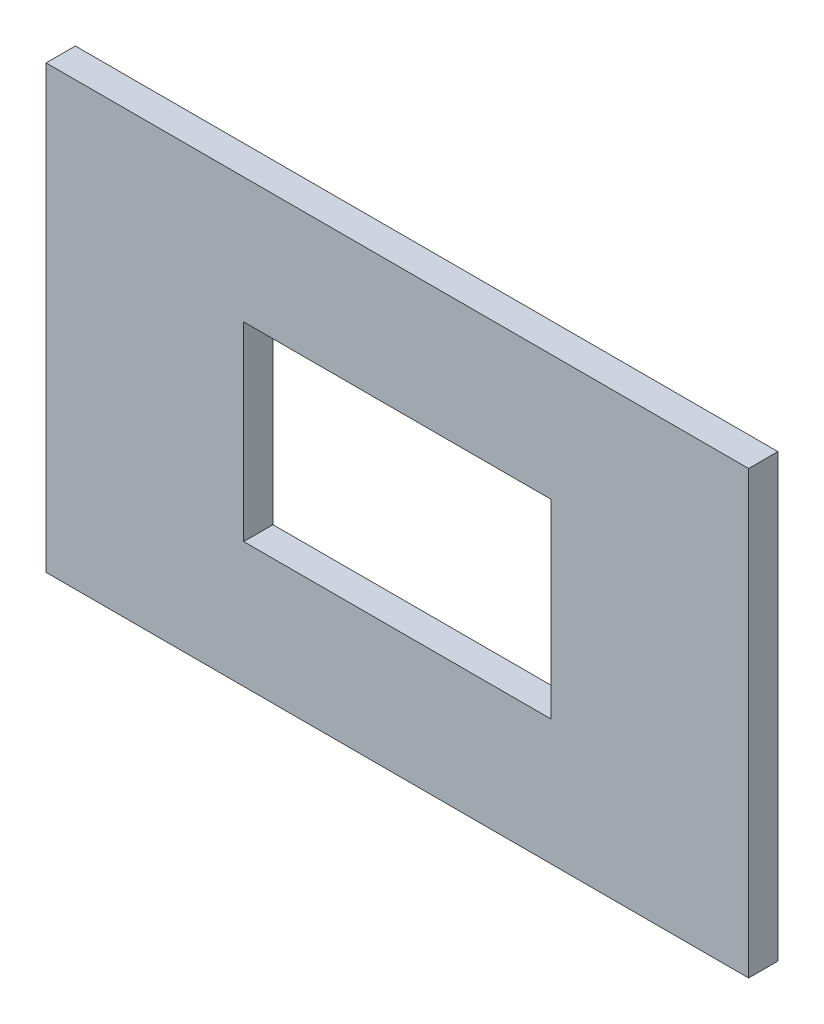
from build123d import *

# Parameters (mm, degrees)
CROQUIS1_W              = 240
CROQUIS1_H              = 150.729909
CROQUIS1_W_2            = 105
CROQUIS1_H_2            = 65
SALIENTE_EXTRUIR1_DEPTH = 10


with BuildPart() as part:
    # Croquis1 → Saliente-Extruir1 (new body)
    with BuildSketch(Plane.XY):
        with Locations((120, 75.3649545)):
            Rectangle(CROQUIS1_W, CROQUIS1_H)
        with Locations((120, 75.3649545)):
            Rectangle(CROQUIS1_W_2, CROQUIS1_H_2, mode=Mode.SUBTRACT)
    extrude(amount=SALIENTE_EXTRUIR1_DEPTH)


solid = part.part
